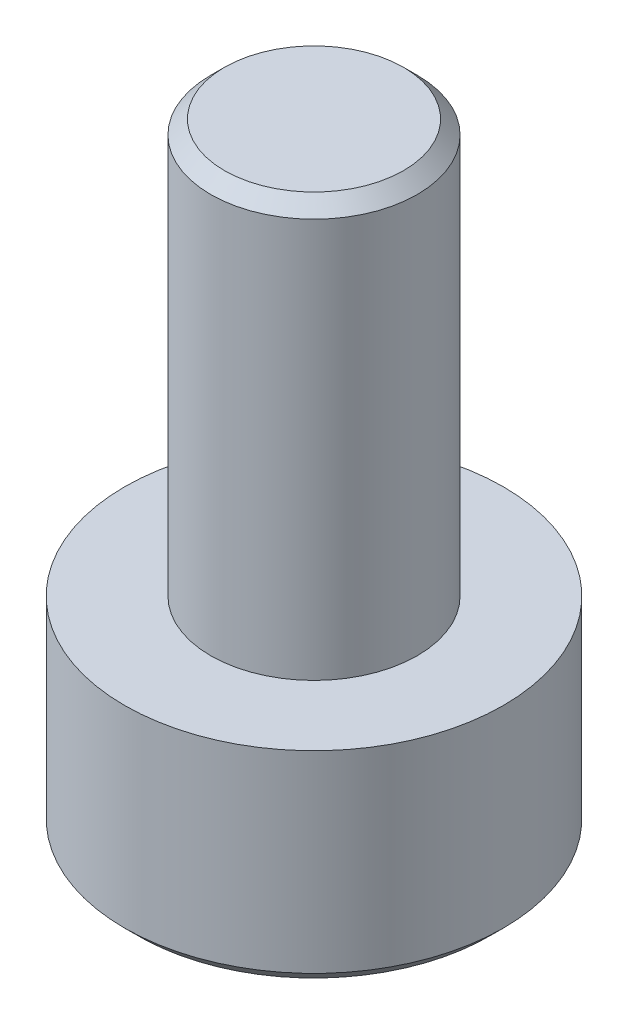
from build123d import *

# Parameters (mm, degrees)
SIMPLIFIED_START                    = -3
SIMPLIFIED_NOMINAL_HEX_SOCKET_DEPTH = 1.5


with BuildPart() as part:
    # Reconstructed nominal axial profile → Native revolved geometry (revolve)
    with BuildSketch(Plane.XY, mode=Mode.PRIVATE) as native_revolved_geometry_sk:
        Polygon((0, -3), (2.55, -3), (2.75, -2.8), (2.75, 0), (1.5, 0), (1.5, 5.8), (1.3, 6), (0, 6), align=None)
    revolve(native_revolved_geometry_sk.sketch.rotate(Axis((0, -500, 0), (0, 1, 0)), 90), axis=Axis((0, -500, 0), (0, 1, 0)))

    # Sketch2 → Simplified nominal hex socket (cut)
    with BuildSketch(Plane(origin=(0, 0, 0), x_dir=(1, 0, 0), z_dir=(0, 1, 0)).offset(SIMPLIFIED_START)):
        Polygon((1.443375673, 0), (0.721687836, -1.25), (-0.721687836, -1.25), (-1.443375673, 0), (-0.721687836, 1.25), (0.721687836, 1.25), align=None)
    extrude(amount=SIMPLIFIED_NOMINAL_HEX_SOCKET_DEPTH, mode=Mode.SUBTRACT)


solid = part.part
